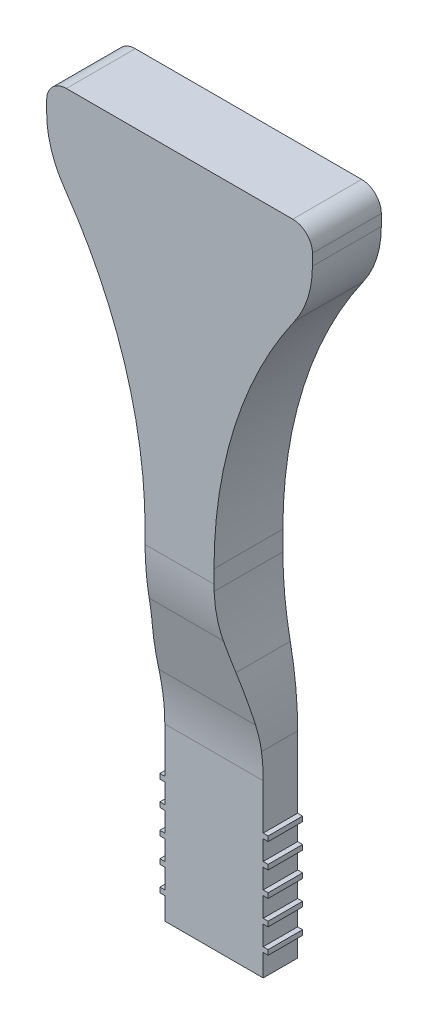
from build123d import *

# Parameters (mm, degrees)
BOSS_EXTRUDE1_DEPTH     = 7
CUT_EXTRUDE4_DEPTH      = 72.7723837
CUT_EXTRUDE4_DEPTH_BACK = 72.7723837
FILLET2_R               = 20
SKETCH5_W               = 3.5
SKETCH5_H               = 0.5
BOSS_EXTRUDE2_DEPTH     = 0.5


with BuildPart() as part:
    # Sketch1 → Boss-Extrude1 (new body)
    with BuildSketch(Plane.XY):
        with BuildLine():
            Line((-5, -50.142890317), (-5, -70.142890317))
            Line((-5, -70.142890317), (5, -70.142890317))
            Line((5, -70.142890317), (5, -50.142890317))
            ThreePointArc((5, -50.142890317), (4.812033579, -46.374186959), (4.25, -42.642890317))
            ThreePointArc((4.25, -42.642890317), (3.687966421, -38.911593674), (3.5, -35.142890317))
            Line((3.5, -35.142890317), (3.5, -33.142890317))
            ThreePointArc((3.5, -33.142890317), (5.594183484, -19.574879811), (11.681818182, -7.269709461))
            ThreePointArc((11.681818182, -7.269709461), (13.034625892, -4.535227161), (13.5, -1.520113715))
            Line((13.5, -1.520113715), (13.5, -0.377223398))
            ThreePointArc((13.5, -0.377223398), (12.914213562, 1.036990164), (11.5, 1.622776602))
            Line((11.5, 1.622776602), (-11.5, 1.622776602))
            ThreePointArc((-11.5, 1.622776602), (-12.914213562, 1.036990164), (-13.5, -0.377223398))
            Line((-13.5, -0.377223398), (-13.5, -1.520113715))
            ThreePointArc((-13.5, -1.520113715), (-13.034625892, -4.535227161), (-11.681818182, -7.269709461))
            ThreePointArc((-11.681818182, -7.269709461), (-5.594183484, -19.574879811), (-3.5, -33.142890317))
            Line((-3.5, -33.142890317), (-3.5, -35.142890317))
            ThreePointArc((-3.5, -35.142890317), (-3.687966421, -38.911593674), (-4.25, -42.642890317))
            ThreePointArc((-4.25, -42.642890317), (-4.812033579, -46.374186959), (-5, -50.142890317))
        make_face()
    extrude(amount=BOSS_EXTRUDE1_DEPTH)

    # Sketch4 → Cut-Extrude4 (cut, two sides: drawn at the far end of the back side and taken through both)
    with BuildSketch(Plane(origin=(0, 0, 0), x_dir=(0, 0, -1), z_dir=(1, 0, 0)).offset(-CUT_EXTRUDE4_DEPTH_BACK)):
        Polygon((-3.5, -70.142890317), (-3.5, -50.142890317), (-7, -37.142890317), (-7, -70.142890317), align=None)
    extrude(amount=CUT_EXTRUDE4_DEPTH + CUT_EXTRUDE4_DEPTH_BACK, mode=Mode.SUBTRACT)

    # Fillet2
    fillet2_edges = [part.edges().sort_by_distance(p)[0] for p in [
        (0, -37.142890317, 7),
        (0, -50.142890317, 3.5),
    ]]
    fillet(fillet2_edges, radius=FILLET2_R)

    # Sketch5 → Boss-Extrude2 (add)
    with BuildSketch(Plane.ZY.offset(5)):
        with Locations((1.75, -65.142890317)):
            Rectangle(SKETCH5_W, SKETCH5_H)
        with Locations((1.75, -62.642890317)):
            Rectangle(SKETCH5_W, SKETCH5_H)
        with Locations((1.75, -60.142890317)):
            Rectangle(SKETCH5_W, SKETCH5_H)
        with Locations((1.75, -67.642890317)):
            Rectangle(SKETCH5_W, SKETCH5_H)
        with Locations((1.75, -57.642890317)):
            Rectangle(SKETCH5_W, SKETCH5_H)
    boss_extrude2 = extrude(amount=BOSS_EXTRUDE2_DEPTH)

    # Mirror1: Boss-Extrude2 across plane
    add(boss_extrude2.mirror(Plane(origin=(0, 0, 0), x_dir=(0, 0, 1), z_dir=(1, 0, 0))))


solid = part.part
